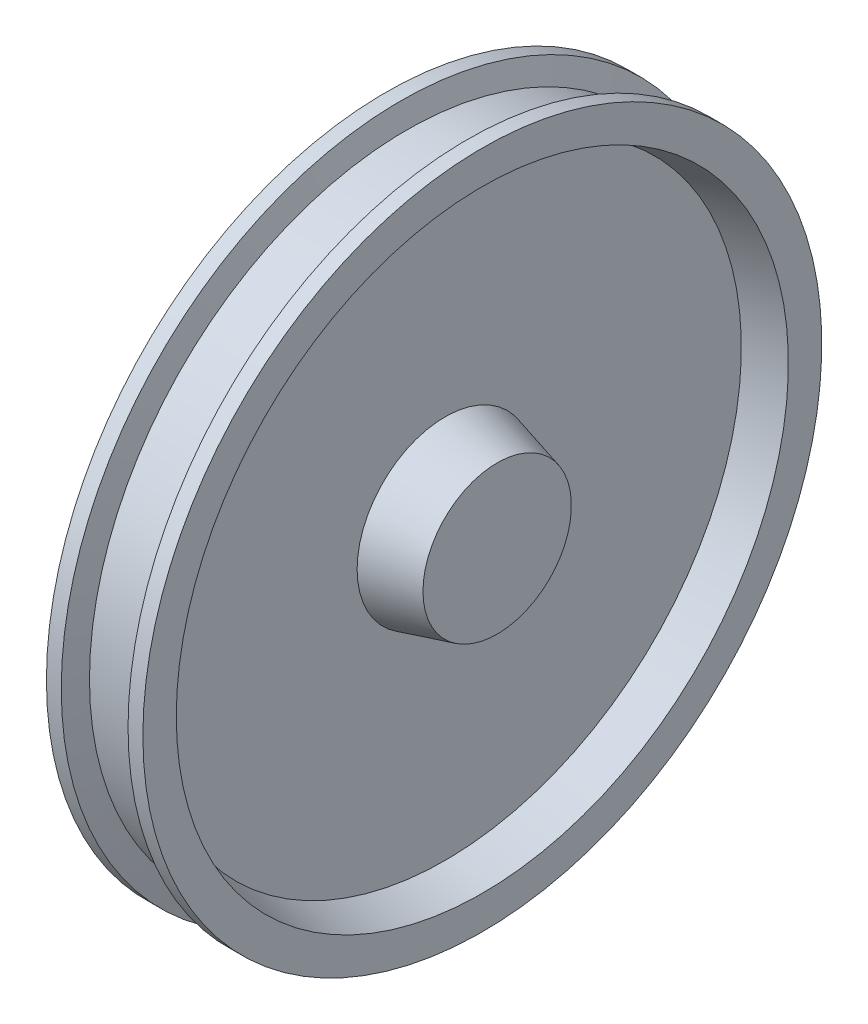
from build123d import *


with BuildPart() as part:
    # Sketch1 → Revolve1 (revolve)
    with BuildSketch(Plane(origin=(0, 0, 0), x_dir=(1, 0, 0), z_dir=(0, 1, 0)), mode=Mode.PRIVATE) as revolve1_sk:
        Polygon((85, 0), (85, 100), (15, 118.75644347), (15, 399.102540378), (65, 412.5), (65, 457.5), (45, 457.5), (36.961524227, 427.5), (-36.961524227, 427.5), (-45, 457.5), (-65, 457.5), (-65, 412.5), (-15, 399.102540378), (-15, 118.75644347), (-85, 100), (-85, 0), align=None)
    revolve(revolve1_sk.sketch.rotate(Axis((-85, 0, 0), (1, 0, 0)), 180), axis=Axis((-85, 0, 0), (1, 0, 0)))


solid = part.part
